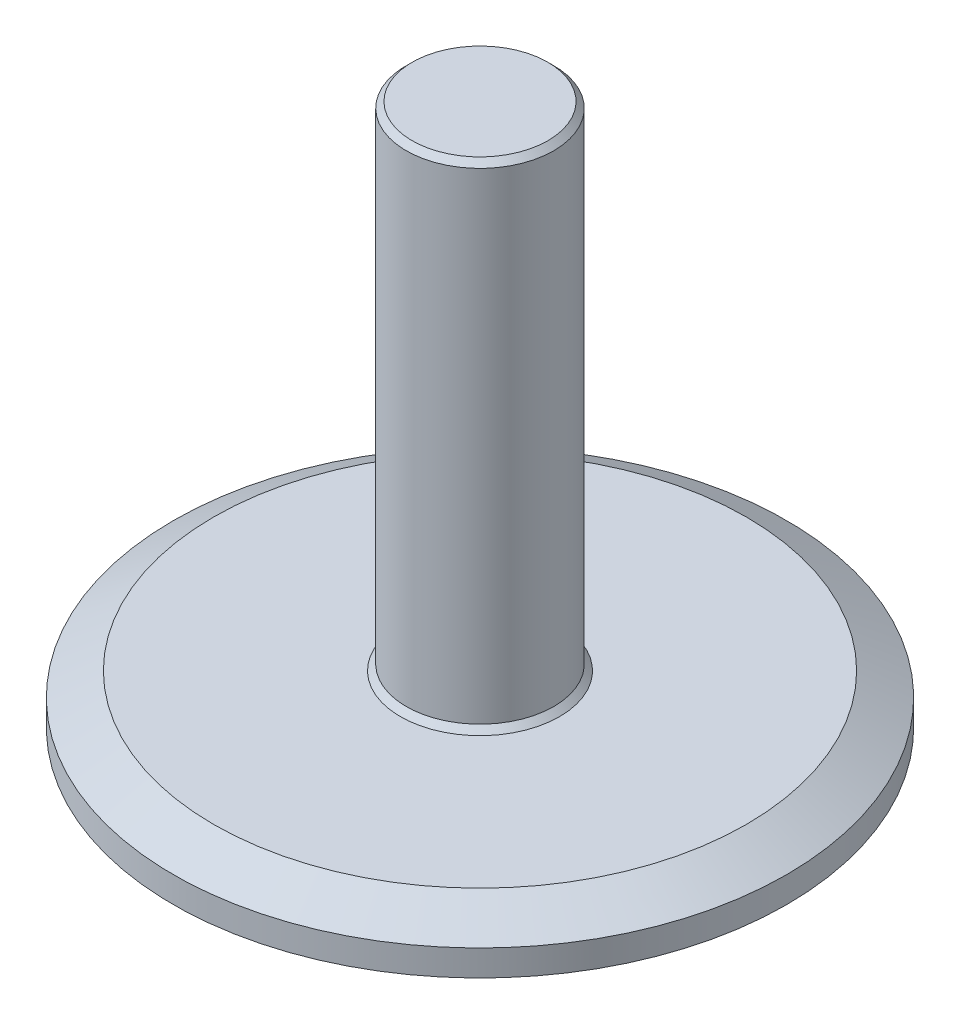
from build123d import *

# Parameters (mm, degrees)
CHAMFER1_SIZE               = 0.75
CHAMFER2_SIZE               = 3
CHAMFER2_SIZE2              = 5.196152423
F_1_4_28_TAPPED_HOLE1_D     = 5.4102
F_1_4_28_TAPPED_HOLE1_DEPTH = 19
F_1_4_28_TAPPED_HOLE1_TIP   = 1.625388061


with BuildPart() as part:
    # Sketch1 → Revolve1 (revolve)
    with BuildSketch(Plane.XY):
        Polygon((0, 0), (0, 70.85), (-9.5, 70.85), (-9.5, 7.35), (-39.5, 7.35), (-39.5, 1), (-32, 1), (-32, 0), align=None)
    revolve(axis=Axis((0, 0, 0), (0, 1, 0)))

    # Chamfer1
    chamfer1_edges = [part.edges().sort_by_distance(p)[0] for p in [
        (9.5, 7.35, 0),
        (9.5, 70.85, 0),
    ]]
    chamfer(chamfer1_edges, length=CHAMFER1_SIZE)

    # Chamfer2
    chamfer2_edges = [part.edges().sort_by_distance(p)[0] for p in [
        (39.5, 7.35, 0),
    ]]
    chamfer2_side = [part.faces().sort_by_distance(p)[0] for p in [
        (39.5, 4.175, 0),
    ]]
    chamfer(chamfer2_edges, length=CHAMFER2_SIZE, length2=CHAMFER2_SIZE2, reference=chamfer2_side[0])

    # 1/4-28 Tapped Hole1
    with Locations(Plane(origin=(0, 0, 0), x_dir=(-1, 0, 0), z_dir=(0, -1, 0))):
        with Locations((0, 0)):
            Hole(F_1_4_28_TAPPED_HOLE1_D / 2, depth=F_1_4_28_TAPPED_HOLE1_DEPTH)
            with Locations((0, 0, -(F_1_4_28_TAPPED_HOLE1_DEPTH + F_1_4_28_TAPPED_HOLE1_TIP / 2))):  # 118° drill point
                Cone(0, F_1_4_28_TAPPED_HOLE1_D / 2, F_1_4_28_TAPPED_HOLE1_TIP, mode=Mode.SUBTRACT)


solid = part.part
